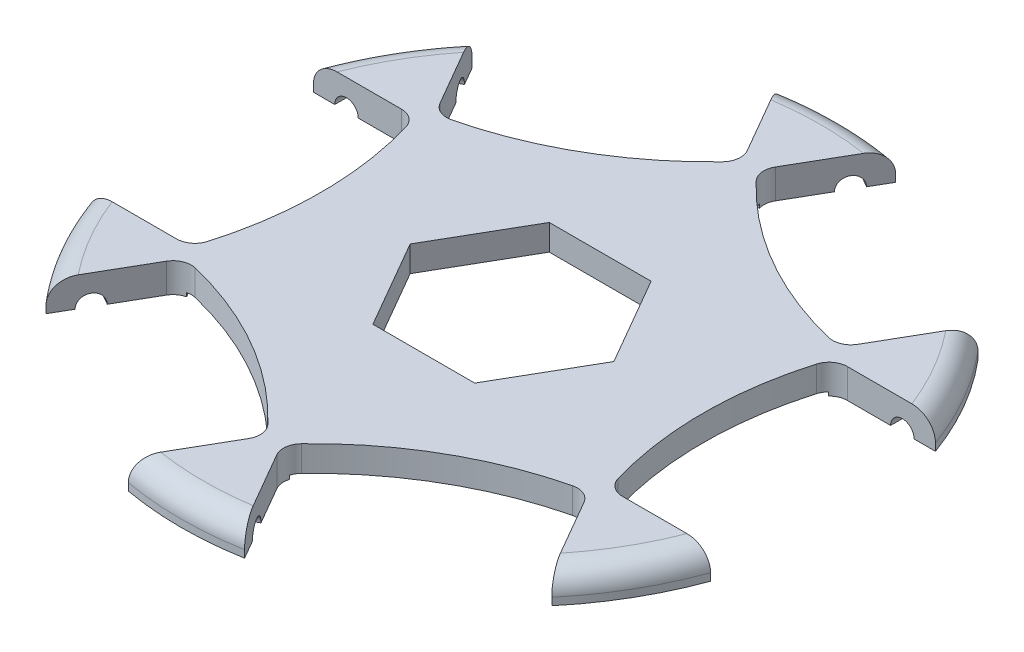
from build123d import *

# Parameters (mm, degrees)
SKIZZE1_R                       = 45
AUFSATZ_LINEAR_AUSTRAGEN1_DEPTH = 4
SCHNITT_LINEAR_START            = -10
SCHNITT_LINEAR_AUSTRAGEN2_DEPTH = 10
KREISMUSTER1_COUNT              = 6
SCHNITT_LINEAR_AUSTRAGEN3_DEPTH = 10
VERRUNDUNG1_R                   = 2.5
SKIZZE5_R                       = 1.6
SCHNITT_LINEAR_AUSTRAGEN5_DEPTH = 3.8
VERRUNDUNG6_R                   = 0.5
KREISMUSTER2_COUNT              = 6
VERRUNDUNG6_OF_KREISMUSTER2_R   = 0.5
SCHNITT_LINEAR_START_2          = -3.8
SKIZZE6_R                       = 1.6
SCHNITT_LINEAR_AUSTRAGEN6_DEPTH = 3.8
VERRUNDUNG7_R                   = 0.5
KREISMUSTER3_COUNT              = 6
VERRUNDUNG7_OF_KREISMUSTER3_R   = 0.5
SKIZZE7_R                       = 32
SCHNITT_LINEAR_AUSTRAGEN7_DEPTH = 0.5
VERRUNDUNG2_R                   = 3


with BuildPart() as part:
    # Skizze1 → Aufsatz-Linear austragen1 (new body)
    with BuildSketch(Plane(origin=(0, 0, 0), x_dir=(1, 0, 0), z_dir=(0, 1, 0))):
        with Locations(Location((0, 0, 0), (0, 0, 270))):
            Circle(SKIZZE1_R)
    extrude(amount=AUFSATZ_LINEAR_AUSTRAGEN1_DEPTH)

    # Skizze2 → Schnitt-Linear austragen2 (cut)
    with BuildSketch(Plane(origin=(0, 4, 0), x_dir=(1, 0, 0), z_dir=(0, 1, 0)).offset(SCHNITT_LINEAR_START)):
        with BuildLine():
            ThreePointArc((-26, 0), (-26.63006939, 7.751752964), (-28.503736417, 15.3))
            Line((-28.503736417, 15.3), (-42.319144604, 15.3))
            ThreePointArc((-42.319144604, 15.3), (-45, 0), (-42.319144604, -15.3))
            Line((-42.319144604, -15.3), (-28.503736417, -15.3))
            ThreePointArc((-28.503736417, -15.3), (-26.63006939, -7.751752964), (-26, 0))
        make_face()
    schnitt_linear_austragen2 = extrude(amount=SCHNITT_LINEAR_AUSTRAGEN2_DEPTH, mode=Mode.SUBTRACT)

    # Kreismuster1: Schnitt-Linear austragen2 ×6 about axis
    kreismuster1_axis = Axis((0, 0, 0), (0, 1, 0))
    for i in range(1, KREISMUSTER1_COUNT):
        add(schnitt_linear_austragen2.rotate(kreismuster1_axis, i * 360 / KREISMUSTER1_COUNT), mode=Mode.SUBTRACT)

    # Skizze3 → Schnitt-Linear austragen3 (cut)
    with BuildSketch(Plane.XZ):
        Polygon((13.856406461, 0), (6.92820323, 12), (-6.92820323, 12), (-13.856406461, 0), (-6.92820323, -12), (6.92820323, -12), align=None)
    extrude(amount=-SCHNITT_LINEAR_AUSTRAGEN3_DEPTH, mode=Mode.SUBTRACT)

    # Verrundung1
    verrundung1_edges = [part.edges().sort_by_distance(p)[0] for p in [
        (-28.503736417, 2, 15.3),
        (-28.503736417, 2, -15.3),
        (-27.502056886, 2, -17.03495984),
        (-1.001679531, 2, -32.33495984),
        (1.001679531, 2, -32.33495984),
        (27.502056886, 2, -17.03495984),
        (28.503736417, 2, -15.3),
        (28.503736417, 2, 15.3),
        (27.502056886, 2, 17.03495984),
        (1.001679531, 2, 32.33495984),
        (-1.001679531, 2, 32.33495984),
        (-27.502056886, 2, 17.03495984),
    ]]
    fillet(verrundung1_edges, radius=VERRUNDUNG1_R)

    # Skizze5 → Schnitt-Linear austragen5 (cut)
    with BuildSketch(Plane(origin=(13.250188678, 0, 7.65), x_dir=(-0.4999999999999918, 0, 0.8660254037844434), z_dir=(-0.8660254037844434, 0, -0.4999999999999918))):
        with Locations((-37.819144604, 0)):
            Circle(SKIZZE5_R)
    schnitt_linear_austragen5 = extrude(amount=-SCHNITT_LINEAR_AUSTRAGEN5_DEPTH, mode=Mode.SUBTRACT)

    # Verrundung6
    verrundung6_edges = [part.edges().sort_by_distance(p)[0] for p in [
        (35.450657514, 1.6, -23.202339976),
    ]]
    fillet(verrundung6_edges, radius=VERRUNDUNG6_R)

    # Kreismuster2: Schnitt-Linear austragen5 ×6 about axis
    kreismuster2_axis = Axis((0, 0, 0), (0, 1, 0))
    for i in range(1, KREISMUSTER2_COUNT):
        add(schnitt_linear_austragen5.rotate(kreismuster2_axis, i * 360 / KREISMUSTER2_COUNT), mode=Mode.SUBTRACT)

    # Verrundung6 of Kreismuster2
    verrundung6_of_kreismuster2_edges = [part.edges().sort_by_distance(p)[0] for p in [
        (-2.36848709, 1.6, -42.302339976),
        (-37.819144604, 1.6, -19.1),
        (-35.450657514, 1.6, 23.202339976),
        (2.36848709, 1.6, 42.302339976),
        (37.819144604, 1.6, 19.1),
    ]]
    fillet(verrundung6_of_kreismuster2_edges, radius=VERRUNDUNG6_OF_KREISMUSTER2_R)

    # Skizze6 → Schnitt-Linear austragen6 (cut)
    with BuildSketch(Plane.XY.offset(-15.3).offset(SCHNITT_LINEAR_START_2)):
        with Locations((37.819144604, 0)):
            Circle(SKIZZE6_R)
    schnitt_linear_austragen6 = extrude(amount=SCHNITT_LINEAR_AUSTRAGEN6_DEPTH, mode=Mode.SUBTRACT)

    # Verrundung7
    verrundung7_edges = [part.edges().sort_by_distance(p)[0] for p in [
        (37.819144604, 1.6, -19.1),
    ]]
    fillet(verrundung7_edges, radius=VERRUNDUNG7_R)

    # Kreismuster3: Schnitt-Linear austragen6 ×6 about axis
    kreismuster3_axis = Axis((0, 0, 0), (0, 1, 0))
    for i in range(1, KREISMUSTER3_COUNT):
        add(schnitt_linear_austragen6.rotate(kreismuster3_axis, i * 360 / KREISMUSTER3_COUNT), mode=Mode.SUBTRACT)

    # Verrundung7 of Kreismuster3
    verrundung7_of_kreismuster3_edges = [part.edges().sort_by_distance(p)[0] for p in [
        (2.36848709, 1.6, -42.302339976),
        (-35.450657514, 1.6, -23.202339976),
        (-37.819144604, 1.6, 19.1),
        (-2.36848709, 1.6, 42.302339976),
        (35.450657514, 1.6, 23.202339976),
    ]]
    fillet(verrundung7_of_kreismuster3_edges, radius=VERRUNDUNG7_OF_KREISMUSTER3_R)

    # Skizze7 → Schnitt-Linear austragen7 (cut)
    with BuildSketch(Plane.XZ):
        Circle(SKIZZE7_R)
    extrude(amount=-SCHNITT_LINEAR_AUSTRAGEN7_DEPTH, mode=Mode.SUBTRACT)

    # Verrundung2
    verrundung2_edges = [part.edges().sort_by_distance(p)[0] for p in [
        (0, 4, 45),
        (38.97114317, 4, 22.5),
        (38.97114317, 4, -22.5),
        (0, 4, -45),
        (-38.97114317, 4, -22.5),
        (-38.97114317, 4, 22.5),
    ]]
    fillet(verrundung2_edges, radius=VERRUNDUNG2_R)


solid = part.part
